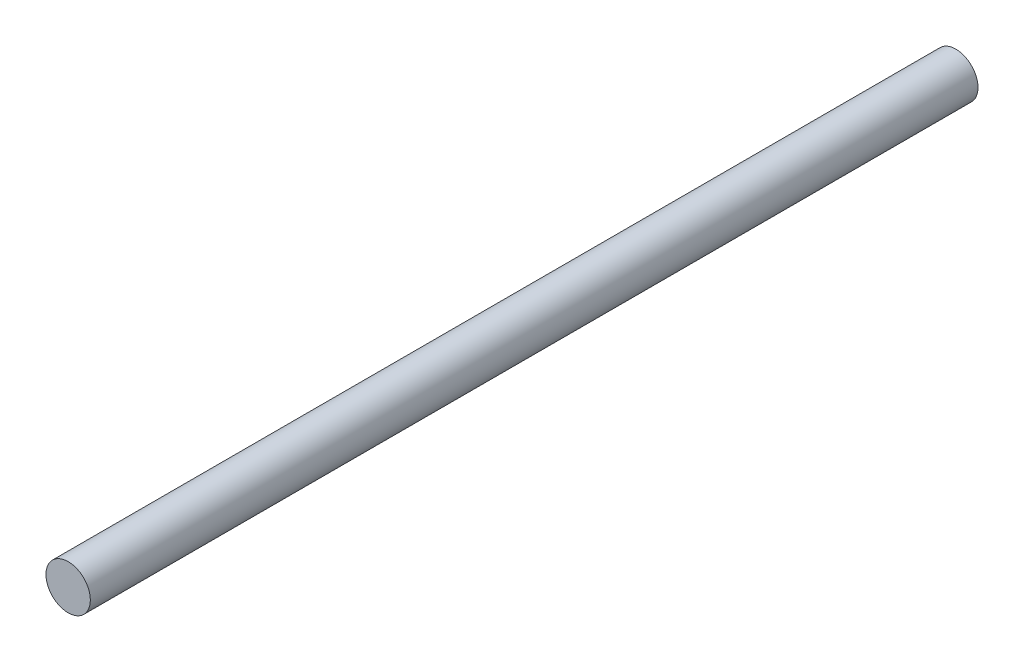
from build123d import *

# Parameters (mm, degrees)
SKETCH1_R           = 2.5
BOSS_EXTRUDE2_DEPTH = 100


with BuildPart() as part:
    # Sketch1 → Boss-Extrude2 (new body)
    with BuildSketch(Plane.XY):
        Circle(SKETCH1_R)
    extrude(amount=BOSS_EXTRUDE2_DEPTH)


solid = part.part
